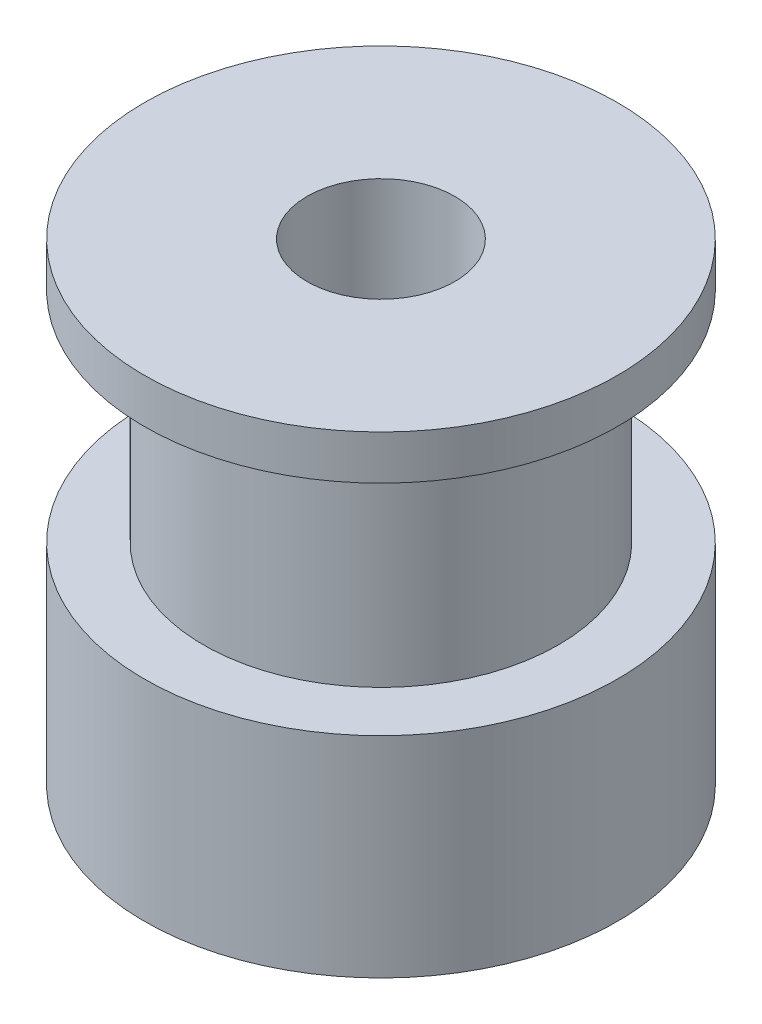
from build123d import *

# Parameters (mm, degrees)
CUT_EXTRUDE_1_REACH = 21.596
SKETCH_2_R          = 2.5


with BuildPart() as part:
    # 草图1 → 旋转1 (revolve)
    with BuildSketch(Plane.XY, mode=Mode.PRIVATE) as revolve_1_sk:
        Polygon((0, 0), (8, 0), (8, 7.1), (6, 7.1), (6, 14.5), (8, 14.5), (8, 16), (0, 16), align=None)
    revolve(revolve_1_sk.sketch.rotate(Axis((0, 16, 0), (0, -1, 0)), 180), axis=Axis((0, 16, 0), (0, -1, 0)))

    # 草图2 → 切除-拉伸1 (cut, up to next)
    with BuildSketch(Plane(origin=(0, 16, 0), x_dir=(1, 0, 0), z_dir=(0, 1, 0)), mode=Mode.PRIVATE) as cut_extrude_1_sk1:
        with Locations(Location((0, 0, 0), (0, 0, 180))):
            Circle(SKETCH_2_R)
    cut_extrude_1_tool1 = extrude(cut_extrude_1_sk1.sketch, amount=-CUT_EXTRUDE_1_REACH, mode=Mode.PRIVATE) & part.part
    add(cut_extrude_1_tool1.solids().sort_by_distance((0, 16, 0))[0], mode=Mode.SUBTRACT)


solid = part.part
